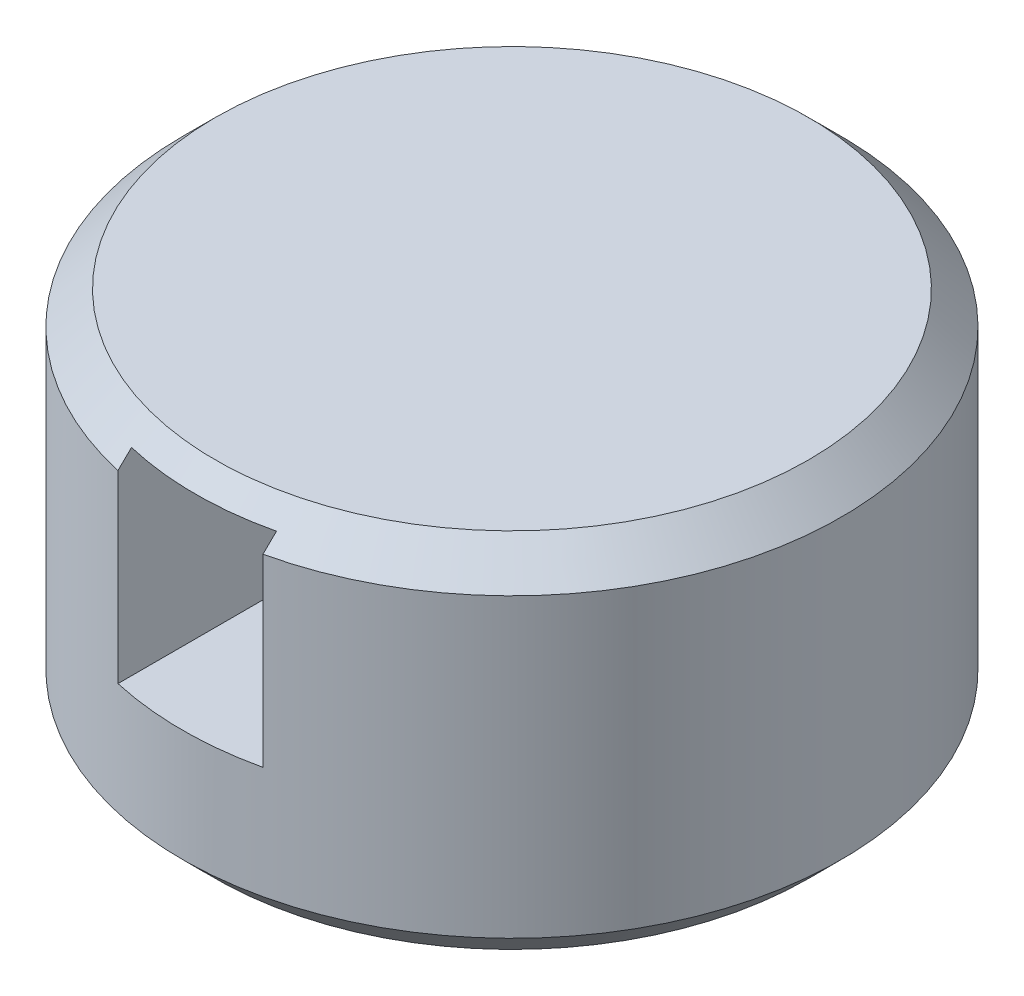
from build123d import *

# Parameters (mm, degrees)
SKETCH2_W          = 22
SKETCH2_H          = 56
CUT_EXTRUDE1_DEPTH = 16
SKETCH3_W          = 22
SKETCH3_H          = 43
CUT_EXTRUDE2_DEPTH = 36
SKETCH5_R          = 12.5
CUT_EXTRUDE4_DEPTH = 16
SKETCH6_W          = 22
SKETCH6_H          = 30
CUT_EXTRUDE5_DEPTH = 97.474089786
SKETCH4_R          = 2.13
CUT_EXTRUDE3_DEPTH = 10


with BuildPart() as part:
    # Sketch1 → Revolve1 (revolve)
    with BuildSketch(Plane.XY, mode=Mode.PRIVATE) as revolve1_sk:
        Polygon((0, 0), (45, 0), (50, 5), (50, 50), (45, 55), (0, 55), align=None)
    revolve(revolve1_sk.sketch.rotate(Axis((0, 55, 0), (0, -1, 0)), 180), axis=Axis((0, 55, 0), (0, -1, 0)))

    # Sketch2 → Cut-Extrude1 (cut)
    with BuildSketch(Plane.XZ):
        with Locations((0, -10)):
            Rectangle(SKETCH2_W, SKETCH2_H)
    extrude(amount=-CUT_EXTRUDE1_DEPTH, mode=Mode.SUBTRACT)

    # Sketch3 → Cut-Extrude2 (cut)
    with BuildSketch(Plane.XZ.offset(-16)):
        with Locations((0, -10)):
            Rectangle(SKETCH3_W, SKETCH3_H)
    extrude(amount=-CUT_EXTRUDE2_DEPTH, mode=Mode.SUBTRACT)

    # Sketch5 → Cut-Extrude4 (cut)
    with BuildSketch(Plane(origin=(0, 0, 0), x_dir=(1, 0, 0), z_dir=(0, 1, 0))):
        Circle(SKETCH5_R)
    extrude(amount=CUT_EXTRUDE4_DEPTH, mode=Mode.SUBTRACT)

    # Sketch6 → Cut-Extrude5 (cut, through all)
    with BuildSketch(Plane(origin=(0, 0, 11.5), x_dir=(-1, 0, 0), z_dir=(0, 0, -1))):
        with Locations((0, 37)):
            Rectangle(SKETCH6_W, SKETCH6_H)
    extrude(amount=-CUT_EXTRUDE5_DEPTH, mode=Mode.SUBTRACT)

    # Sketch4 → Cut-Extrude3 (cut)
    with BuildSketch(Plane.XZ.offset(-16)):
        with Locations((-5, 14.65)):
            Circle(SKETCH4_R)
        with Locations(Location((5, 14.65, 0), (0, 0, 270))):
            Circle(SKETCH4_R)
        with Locations((5, -34.85)):
            Circle(SKETCH4_R)
        with Locations(Location((-5, -34.85, 0), (0, 0, 180))):
            Circle(SKETCH4_R)
    extrude(amount=-CUT_EXTRUDE3_DEPTH, mode=Mode.SUBTRACT)


solid = part.part
